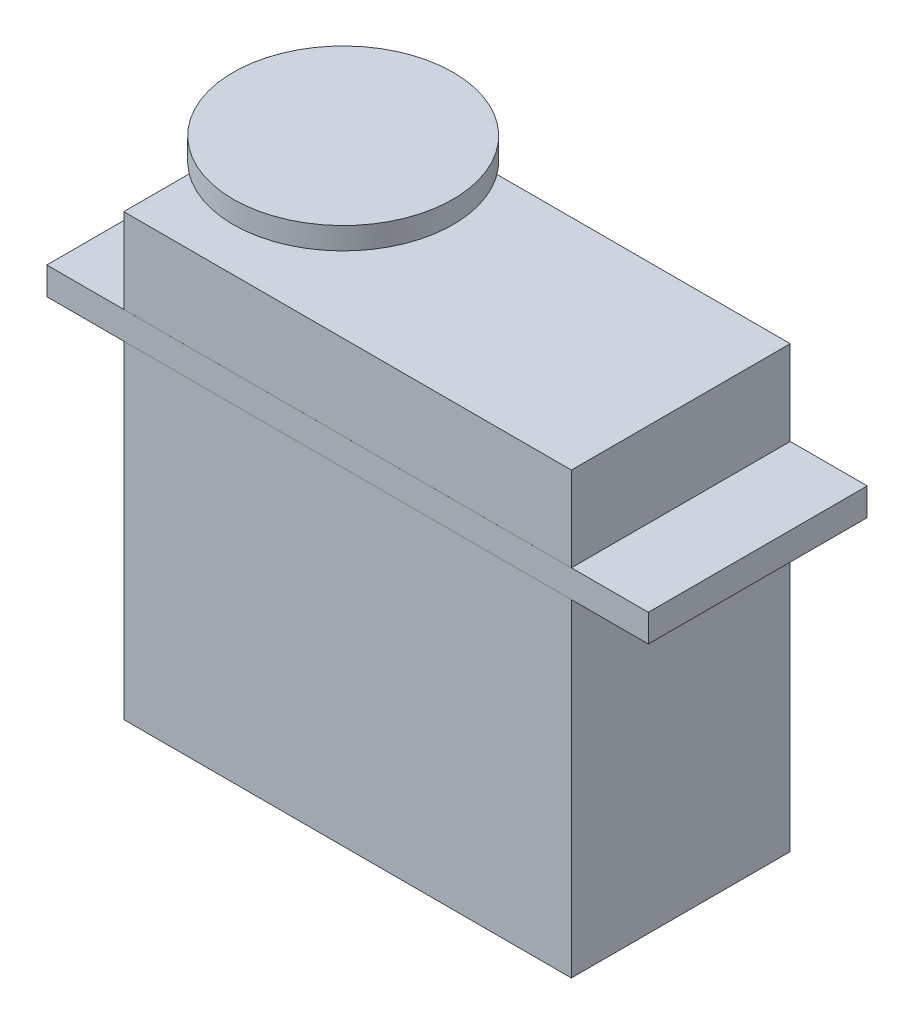
from build123d import *

# Parameters (mm, degrees)
SKETCH_1_W      = 40.7
SKETCH_1_H      = 19.9
EXTRUDE_1_DEPTH = 40
SKETCH_2_R      = 3
EXTRUDE_2_DEPTH = 6
EXTRUDE_START   = -7.7
SKETCH_3_W      = 54.7
SKETCH_3_H      = 19.901230414
EXTRUDE_3_DEPTH = 2.5
SKETCH_4_R      = 10
EXTRUDE_4_DEPTH = 2


with BuildPart() as part:
    # 스케치1 → 보스-돌출1 (new body)
    with BuildSketch(Plane(origin=(0, 0, 0), x_dir=(1, 0, 0), z_dir=(0, 1, 0))):
        Rectangle(SKETCH_1_W, SKETCH_1_H)
    extrude(amount=EXTRUDE_1_DEPTH)

    # 스케치2 → 보스-돌출2 (add)
    with BuildSketch(Plane(origin=(0, 40, 0), x_dir=(1, 0, 0), z_dir=(0, 1, 0))):
        with Locations(Location((-10.35, 0, 0), (0, 0, 270))):
            Circle(SKETCH_2_R)
    extrude(amount=EXTRUDE_2_DEPTH)

    # 스케치3 → 보스-돌출3 (add)
    with BuildSketch(Plane(origin=(0, 40, 0), x_dir=(1, 0, 0), z_dir=(0, 1, 0)).offset(EXTRUDE_START)):
        Rectangle(SKETCH_3_W, SKETCH_3_H)
    extrude(amount=-EXTRUDE_3_DEPTH)

    # 스케치4 → 보스-돌출4 (add)
    with BuildSketch(Plane(origin=(0, 46, 0), x_dir=(1, 0, 0), z_dir=(0, 1, 0))):
        with Locations(Location((-10.35, 0, 0), (0, 0, 270))):
            Circle(SKETCH_4_R)
    extrude(amount=-EXTRUDE_4_DEPTH)


solid = part.part
